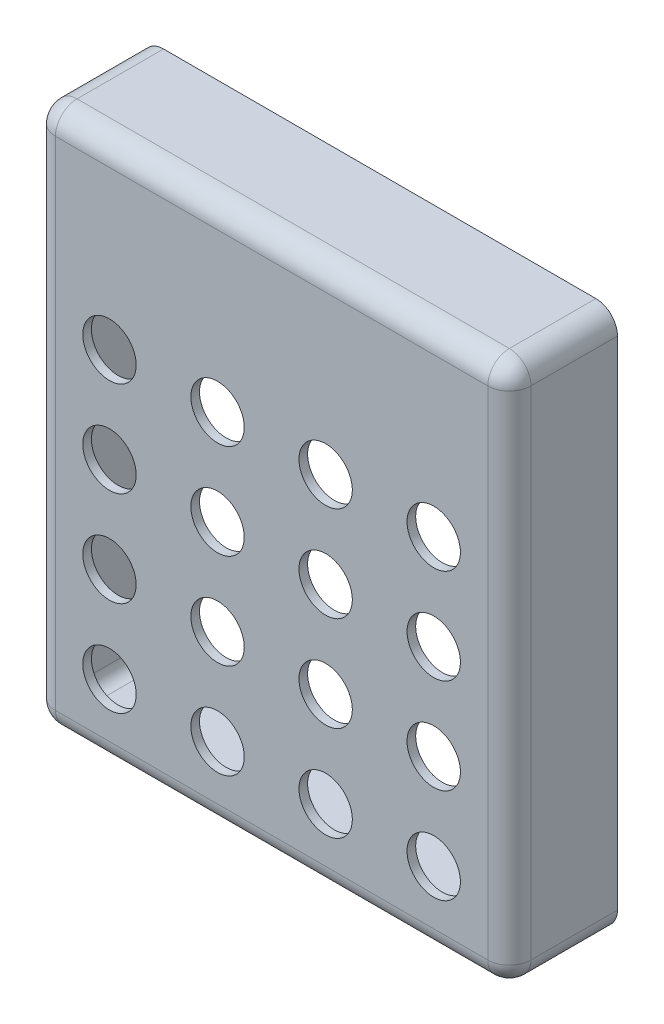
from build123d import *

# Parameters (mm, degrees)
BOSS_EXTRUDE1_DEPTH = 25
FILLET1_R           = 5
SHELL1_T            = -2
SKETCH2_R           = 6.175
CUT_EXTRUDE2_DEPTH  = 25
CUT_EXTRUDE4_DEPTH  = 25
SKETCH4_R           = 1.25
SKETCH4_R_2         = 0.5
BOSS_EXTRUDE2_DEPTH = 7
SKETCH5_W           = 50.970389208
SKETCH5_H           = 16.037024898
CUT_EXTRUDE5_DEPTH  = 1.5


with BuildPart() as part:
    # Sketch1 → Boss-Extrude1 (new body)
    with BuildSketch(Plane.XY):
        with BuildLine():
            Line((-50, -62.5), (50, -62.5))
            ThreePointArc((50, -62.5), (53.535533906, -61.035533906), (55, -57.5))
            Line((55, -57.5), (55, 57.5))
            ThreePointArc((55, 57.5), (53.535533906, 61.035533906), (50, 62.5))
            Line((50, 62.5), (-50, 62.5))
            ThreePointArc((-50, 62.5), (-53.535533906, 61.035533906), (-55, 57.5))
            Line((-55, 57.5), (-55, -57.5))
            ThreePointArc((-55, -57.5), (-53.535533906, -61.035533906), (-50, -62.5))
        make_face()
    extrude(amount=BOSS_EXTRUDE1_DEPTH)

    # Fillet1
    fillet1_edges = [part.edges().sort_by_distance(p)[0] for p in [
        (53.535533906, -61.035533906, 25),
        (55, 0, 25),
        (53.535533906, 61.035533906, 25),
        (0, 62.5, 25),
        (-53.535533906, 61.035533906, 25),
        (-55, 0, 25),
        (-53.535533906, -61.035533906, 25),
        (0, -62.5, 25),
    ]]
    fillet(fillet1_edges, radius=FILLET1_R)

    # Shell1
    shell1_openings = [part.faces().sort_by_distance(p)[0] for p in [
        (0, 0, 0),
    ]]
    offset(amount=SHELL1_T, openings=shell1_openings, kind=Kind.INTERSECTION)

    # Sketch2 → Cut-Extrude2 (cut)
    with BuildSketch(Plane.XY.offset(25)):
        with Locations((-37.5, -45)):
            Circle(SKETCH2_R)
        with Locations((-12.5, -45)):
            Circle(SKETCH2_R)
        with Locations((12.5, -45)):
            Circle(SKETCH2_R)
        with Locations((37.5, -45)):
            Circle(SKETCH2_R)
        with Locations((-37.5, -23)):
            Circle(SKETCH2_R)
        with Locations((-12.5, -23)):
            Circle(SKETCH2_R)
        with Locations((12.5, -23)):
            Circle(SKETCH2_R)
        with Locations((37.5, -23)):
            Circle(SKETCH2_R)
        with Locations((-37.5, -1)):
            Circle(SKETCH2_R)
        with Locations((-12.5, -1)):
            Circle(SKETCH2_R)
        with Locations((12.5, -1)):
            Circle(SKETCH2_R)
        with Locations((37.5, -1)):
            Circle(SKETCH2_R)
        with Locations((-37.5, 21)):
            Circle(SKETCH2_R)
        with Locations((-12.5, 21)):
            Circle(SKETCH2_R)
        with Locations((12.5, 21)):
            Circle(SKETCH2_R)
        with Locations((37.5, 21)):
            Circle(SKETCH2_R)
    extrude(amount=-CUT_EXTRUDE2_DEPTH, mode=Mode.SUBTRACT)

    # Sketch3 → Cut-Extrude4 (cut)
    with BuildSketch(Plane.ZY.offset(55)):
        with BuildLine():
            Line((14.181299903, 43.9), (16.681299903, 42.5))
            ThreePointArc((16.681299903, 42.5), (17.034853293, 42.646446609), (17.181299903, 43))
            Line((17.181299903, 43), (17.181299903, 50))
            ThreePointArc((17.181299903, 50), (17.034853293, 50.353553391), (16.681299903, 50.5))
            Line((16.681299903, 50.5), (14.181299903, 49.1))
            Line((14.181299903, 49.1), (14.181299903, 43.9))
        make_face()
    extrude(amount=-CUT_EXTRUDE4_DEPTH, mode=Mode.SUBTRACT)

    # Sketch4 → Boss-Extrude2 (add)
    # profile 1 of 4: a face of its own
    with BuildSketch(Plane(origin=(0, 0, 17.181299903), x_dir=(-1, 0, 0), z_dir=(0, 0, -1))):
        with Locations((50.75, 40.469217889)):
            Circle(SKETCH4_R)
        with Locations((50.75, 40.469217889)):
            Circle(SKETCH4_R_2, mode=Mode.SUBTRACT)
    # profile 2 of 4: a face of its own
    with BuildSketch(Plane(origin=(0, 0, 17.181299903), x_dir=(-1, 0, 0), z_dir=(0, 0, -1))):
        with Locations((50.75, 52.469217889)):
            Circle(SKETCH4_R)
        with Locations((50.75, 52.469217889)):
            Circle(SKETCH4_R_2, mode=Mode.SUBTRACT)
    # profile 3 of 4: a face of its own
    with BuildSketch(Plane(origin=(0, 0, 17.181299903), x_dir=(-1, 0, 0), z_dir=(0, 0, -1))):
        with Locations((4.25, 52.469217889)):
            Circle(SKETCH4_R)
        with Locations((4.25, 52.469217889)):
            Circle(SKETCH4_R_2, mode=Mode.SUBTRACT)
    # profile 4 of 4: a face of its own
    with BuildSketch(Plane(origin=(0, 0, 17.181299903), x_dir=(-1, 0, 0), z_dir=(0, 0, -1))):
        with Locations((4.25, 40.469217889)):
            Circle(SKETCH4_R)
        with Locations((4.25, 40.469217889)):
            Circle(SKETCH4_R_2, mode=Mode.SUBTRACT)
    extrude(amount=-BOSS_EXTRUDE2_DEPTH)

    # Sketch5 → Cut-Extrude5 (cut)
    with BuildSketch(Plane(origin=(0, 0, 17.181299903), x_dir=(-1, 0, 0), z_dir=(0, 0, -1))):
        with Locations((26.773560326, 46.339549131)):
            Rectangle(SKETCH5_W, SKETCH5_H)
    extrude(amount=-CUT_EXTRUDE5_DEPTH, mode=Mode.SUBTRACT)


solid = part.part
